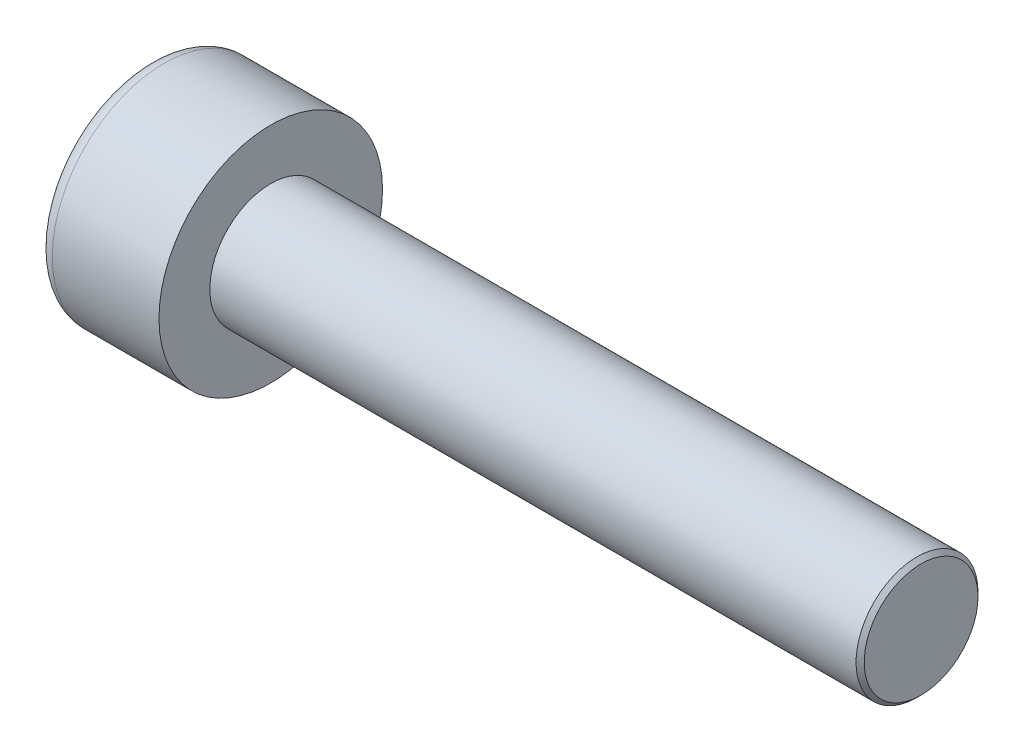
from build123d import *

# Parameters (mm, degrees)
SKETCH1_R           = 2.75
BASEHEAD_DEPTH      = 3
SKETCH2_R           = 1.5
BASEBODY_DEPTH      = 16
HEXAGONSOCKET_DEPTH = 1.3
TOPFILLET_R         = 0.375
CHAMFER1_SIZE       = 0.1


with BuildPart() as part:
    # Sketch1 → BaseHead (new body)
    with BuildSketch(Plane(origin=(0, 0, 0), x_dir=(0, 0, -1), z_dir=(1, 0, 0))):
        Circle(SKETCH1_R)
    extrude(amount=BASEHEAD_DEPTH)

    # Sketch2 → BaseBody (add)
    with BuildSketch(Plane(origin=(3, 0, 0), x_dir=(0, 0, -1), z_dir=(1, 0, 0))):
        Circle(SKETCH2_R)
    extrude(amount=BASEBODY_DEPTH)

    # Sketch3 → HexagonSocket (cut)
    with BuildSketch(Plane(origin=(0, 0, 0), x_dir=(0, 0, -1), z_dir=(1, 0, 0))):
        Polygon((1.443375673, 0), (0.721687836, 1.25), (-0.721687836, 1.25), (-1.443375673, 0), (-0.721687836, -1.25), (0.721687836, -1.25), align=None)
    extrude(amount=HEXAGONSOCKET_DEPTH, mode=Mode.SUBTRACT)

    # Sketch4 → Cut-Revolve1 (revolve, cut)
    with BuildSketch(Plane(origin=(-4.19613823, 0.75, 0), x_dir=(-1, 0, 0), z_dir=(0, 0, 1)), mode=Mode.PRIVATE) as cut_revolve1_sk:
        Polygon((-5.49613823, 2), (-6.217826066, 0.75), (-5.49613823, 0.75), align=None)
    revolve(cut_revolve1_sk.sketch.rotate(Axis((0.838992387, 0, 0), (-1, 0, 0)), 90), axis=Axis((0.838992387, 0, 0), (-1, 0, 0)), mode=Mode.SUBTRACT)

    # TopFillet
    topfillet_edges = [part.edges().sort_by_distance(p)[0] for p in [
        (0, 0, 2.75),
    ]]
    fillet(topfillet_edges, radius=TOPFILLET_R)

    # Chamfer1
    chamfer1_edges = [part.edges().sort_by_distance(p)[0] for p in [
        (19, 0, 1.5),
    ]]
    chamfer(chamfer1_edges, length=CHAMFER1_SIZE)


solid = part.part
